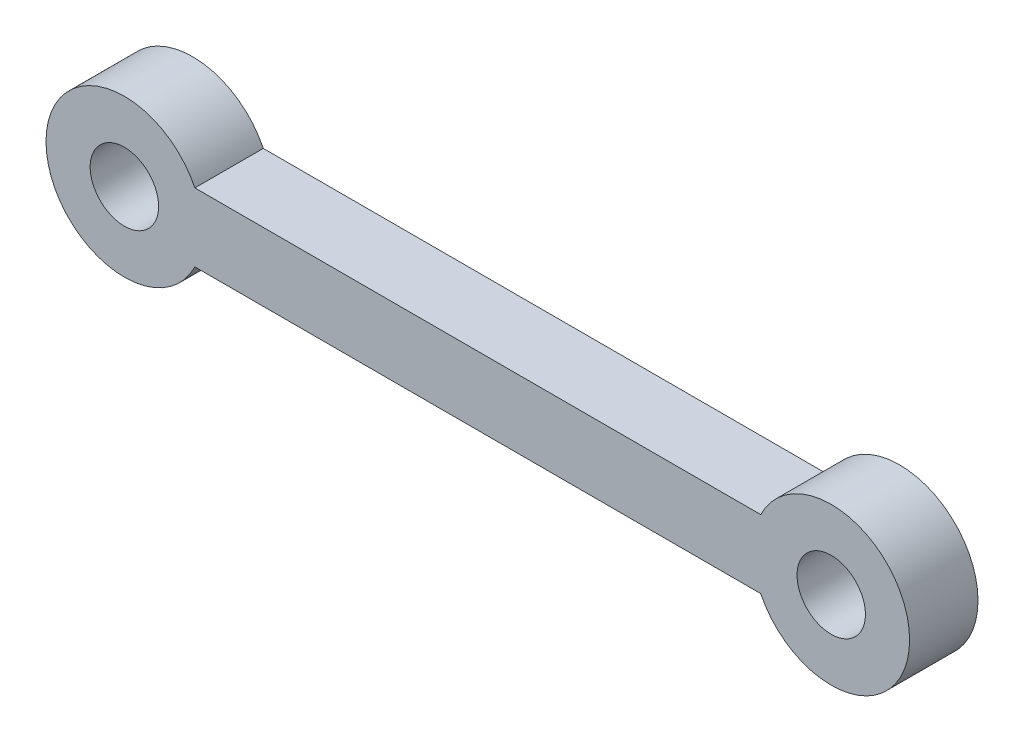
from build123d import *

# Parameters (mm, degrees)
SKETCH2_R           = 3.436597574
SKETCH2_R_2         = 1.5
BOSS_EXTRUDE1_DEPTH = 3


with BuildPart() as part:
    # Sketch2 → Boss-Extrude1 (new body)
    # profile 1 of 3: a face of its own
    with BuildSketch(Plane.XY):
        with Locations((-14.105820106, 0)):
            Circle(SKETCH2_R)
        with Locations((-14.105820106, 0)):
            Circle(SKETCH2_R_2, mode=Mode.SUBTRACT)
    # profile 2 of 3: a face of its own
    with BuildSketch(Plane.XY):
        with BuildLine():
            Line((13.802222119, 1.5), (-11.01386233, 1.5))
            ThreePointArc((-11.01386233, 1.5), (-10.756490511, 0.769541518), (-10.669222532, 0))
            ThreePointArc((-10.669222532, 0), (-10.756490511, -0.769541518), (-11.01386233, -1.5))
            Line((-11.01386233, -1.5), (13.802222119, -1.5))
            ThreePointArc((13.802222119, -1.5), (13.45758232, 0), (13.802222119, 1.5))
        make_face()
    # profile 3 of 3: a face of its own
    with BuildSketch(Plane.XY):
        with Locations((16.894179894, 0)):
            Circle(SKETCH2_R)
        with Locations((16.894179894, 0)):
            Circle(SKETCH2_R_2, mode=Mode.SUBTRACT)
    extrude(amount=BOSS_EXTRUDE1_DEPTH)


solid = part.part
